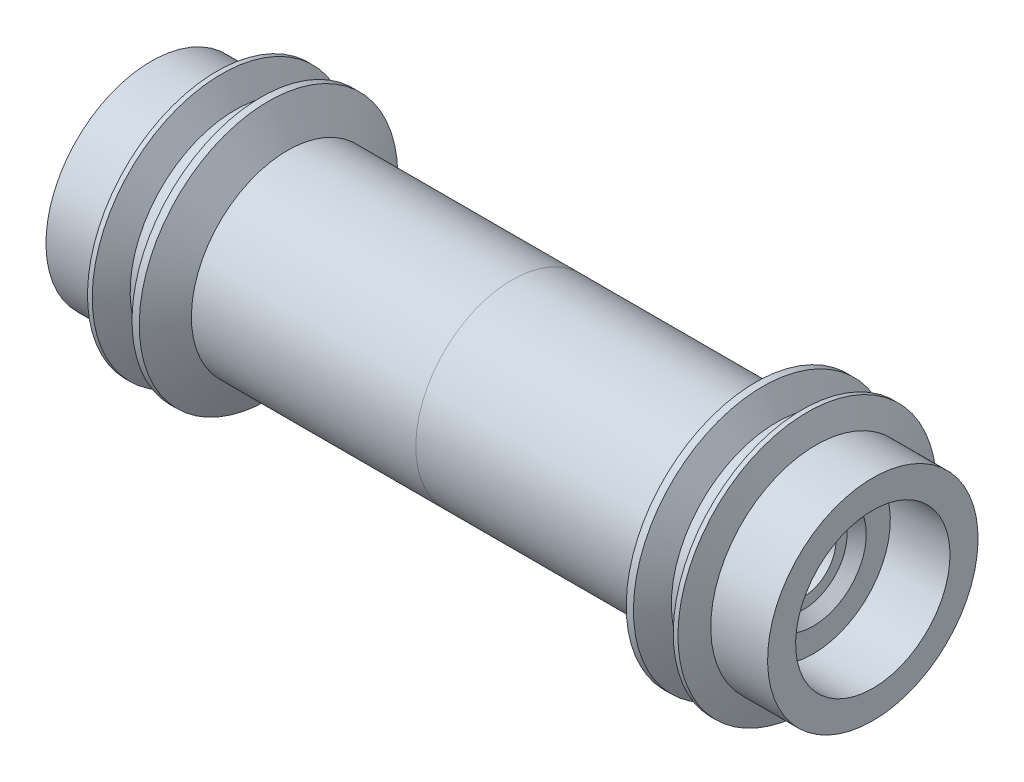
from build123d import *

# Parameters (mm, degrees)
CHAMFER1_SIZE = 0.508


with BuildPart() as part:
    # Sketch2 → Revolve1 (revolve)
    with BuildSketch(Plane.XY, mode=Mode.PRIVATE) as revolve1_sk:
        Polygon((-16.05, 5.55625), (-19.05, 5.55625), (-19.05, 4.075), (-15.9, 4.075), (-15.9, 2.805), (-15.392, 2.297), (-15.392, 1.7145), (-9.225, 1.7145), (-9.225, 0), (-8.1, 0), (-6.5, 1.6), (0, 1.6), (0, 5.08), (-11.847567251, 5.08), (-12.855765158, 6.82625), (-13.236765158, 6.82625), (-13.97, 5.55625), (-14.605, 5.55625), (-15.338234842, 6.82625), (-15.587757802, 6.82625), align=None)
    revolve(revolve1_sk.sketch.rotate(Axis((-19.05, 0, 0), (1, 0, 0)), 180), axis=Axis((-19.05, 0, 0), (1, 0, 0)))


with BuildPart() as body_2:
    # Mirror1: mirrored copy
    add(part.part.mirror(Plane(origin=(0, 0, 0), x_dir=(0, 0, 1), z_dir=(1, 0, 0))))


with BuildPart() as part_1:
    add(part.part)

    # Chamfer1
    chamfer1_edges = [part_1.edges().sort_by_distance(p)[0] for p in [
        (-19.05, 4.075, 0),
    ]]
    chamfer(chamfer1_edges, length=CHAMFER1_SIZE)


solid = Compound([body_2.part, part_1.part])
